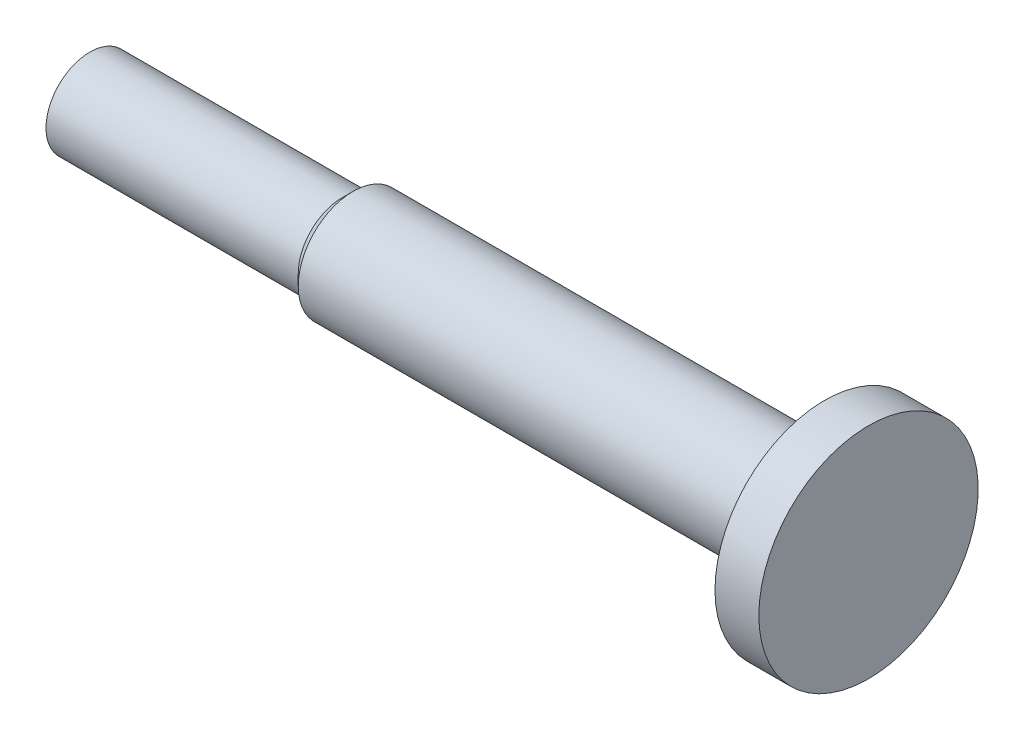
from build123d import *


with BuildPart() as part:
    # 草图1 → 旋转1 (revolve)
    with BuildSketch(Plane.XY, mode=Mode.PRIVATE) as revolve_1_sk:
        Polygon((-12, 0), (-12, 2), (-0.5, 2), (0, 2.5), (21.5, 2.5), (21.5, 5), (23.5, 5), (23.5, 0), align=None)
    revolve(revolve_1_sk.sketch.rotate(Axis((23.5, 0, 0), (-1, 0, 0)), 270), axis=Axis((23.5, 0, 0), (-1, 0, 0)))


solid = part.part
